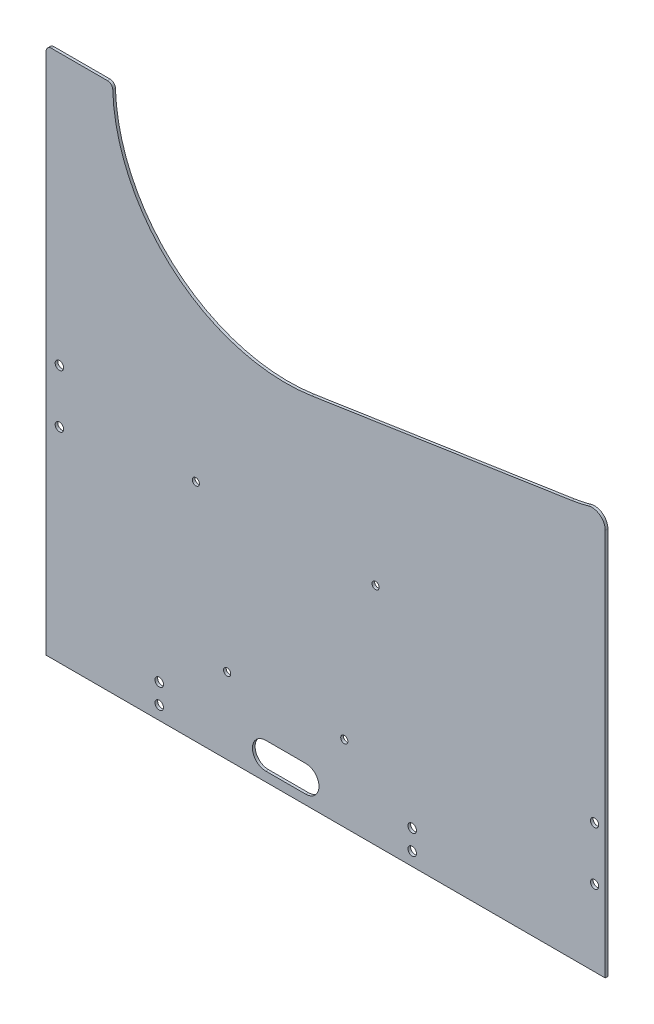
from build123d import *

# Parameters (mm, degrees)
SKETCH_1_W           = 210
SKETCH_1_H           = 233
EXTRUDE_1_DEPTH      = 1
SKETCH_2_R           = 65
CUT_EXTRUDE_1_DEPTH  = 2
SKETCH_3_W           = 210
SKETCH_3_H           = 16.25
CUT_EXTRUDE_2_DEPTH  = 2
SKETCH_4_W           = 210
SKETCH_4_H           = 0.1
CUT_EXTRUDE_3_DEPTH  = 2
CUT_EXTRUDE_4_DEPTH  = 2
SKETCH_8_R           = 1.6
CUT_EXTRUDE_6_DEPTH  = 1
SKETCH_12_R          = 1.35
CUT_EXTRUDE_9_DEPTH  = 10
CUT_EXTRUDE_10_DEPTH = 10
FILLET_3_R           = 2
SKETCH_15_R          = 1.6
CUT_EXTRUDE_12_DEPTH = 10
SKETCH_17_R          = 1.55
CUT_EXTRUDE_13_DEPTH = 10
CUT_EXTRUDE_14_DEPTH = 10
FILLET_6_R           = 5
SKETCH_24_W          = 210
SKETCH_24_H          = 18.25
CUT_EXTRUDE_18_DEPTH = 10


with BuildPart() as part:
    # 草图1 → 凸台-拉伸1 (new body)
    with BuildSketch(Plane.XY):
        Rectangle(SKETCH_1_W, SKETCH_1_H)
    extrude(amount=EXTRUDE_1_DEPTH)

    # 草图2 → 切除-拉伸1 (cut)
    with BuildSketch(Plane.XY.offset(1)):
        with Locations((-15, 100.25)):
            Circle(SKETCH_2_R)
    extrude(amount=-CUT_EXTRUDE_1_DEPTH, mode=Mode.SUBTRACT)

    # 草图3 → 切除-拉伸2 (cut)
    with BuildSketch(Plane.XY.offset(1)):
        with Locations((0, 108.375)):
            Rectangle(SKETCH_3_W, SKETCH_3_H)
    extrude(amount=-CUT_EXTRUDE_2_DEPTH, mode=Mode.SUBTRACT)

    # 草图4 → 切除-拉伸3 (cut)
    with BuildSketch(Plane.XY.offset(1)):
        with Locations((0, 100.2)):
            Rectangle(SKETCH_4_W, SKETCH_4_H)
    extrude(amount=-CUT_EXTRUDE_3_DEPTH, mode=Mode.SUBTRACT)

    # 草图5 → 切除-拉伸4 (cut)
    with BuildSketch(Plane.XY.offset(1)):
        with BuildLine():
            Line((4.5, 38.243951908), (95.5, 66.86212795))
            ThreePointArc((95.5, 66.86212795), (105.715966735, 128.460790883), (50.000008252, 100.274034742))
            Line((50.000008252, 100.274034742), (49.999923077, 100.15))
            ThreePointArc((49.999923077, 100.15), (37.375079452, 61.755181486), (4.5, 38.243951908))
        make_face()
    extrude(amount=-CUT_EXTRUDE_4_DEPTH, mode=Mode.SUBTRACT)

    # 草图8 → 切除-拉伸6 (cut)
    with BuildSketch(Plane.XY.offset(1)):
        with Locations((-100, -21.5)):
            Circle(SKETCH_8_R)
        with Locations((-100, -1.5)):
            Circle(SKETCH_8_R)
    extrude(amount=-CUT_EXTRUDE_6_DEPTH, mode=Mode.SUBTRACT)

    # 草图12 → 切除-拉伸9 (cut)
    with BuildSketch(Plane(origin=(0, 0, 0), x_dir=(-1, 0, 0), z_dir=(0, 0, -1))):
        with Locations((-18.75, -13.7)):
            Circle(SKETCH_12_R)
        with Locations((48.75, -13.7)):
            Circle(SKETCH_12_R)
        with Locations((-7, -69.7)):
            Circle(SKETCH_12_R)
        with Locations((37, -69.7)):
            Circle(SKETCH_12_R)
    extrude(amount=-CUT_EXTRUDE_9_DEPTH, mode=Mode.SUBTRACT)

    # 草图13 → 切除-拉伸10 (cut)
    with BuildSketch(Plane(origin=(0, 0, 0), x_dir=(-1, 0, 0), z_dir=(0, 0, -1))):
        with BuildLine():
            Line((7.5, -84.7), (22.5, -84.7))
            ThreePointArc((22.5, -84.7), (27.5, -89.7), (22.5, -94.7))
            Line((22.5, -94.7), (7.5, -94.7))
            ThreePointArc((7.5, -94.7), (2.5, -89.7), (7.5, -84.7))
        make_face()
    extrude(amount=-CUT_EXTRUDE_10_DEPTH, mode=Mode.SUBTRACT)

    # 圆角3
    fillet_3_edges = [part.edges().sort_by_distance(p)[0] for p in [
        (105, 71.527186767, 0.5),
        (-79.999923077, 100.15, 0.5),
        (-105, 100.15, 0.5),
        (105, -116.5, 0.5),
        (-105, -116.5, 0.5),
    ]]
    fillet(fillet_3_edges, radius=FILLET_3_R)

    # 草图15 → 切除-拉伸12 (cut)
    with BuildSketch(Plane(origin=(0, 0, 0), x_dir=(-1, 0, 0), z_dir=(0, 0, -1))):
        with Locations((-32.5, -85.75)):
            Circle(SKETCH_15_R)
        with Locations((-32.5, -93.25)):
            Circle(SKETCH_15_R)
        with Locations((62.5, -85.75)):
            Circle(SKETCH_15_R)
        with Locations((62.5, -93.25)):
            Circle(SKETCH_15_R)
    extrude(amount=-CUT_EXTRUDE_12_DEPTH, mode=Mode.SUBTRACT)

    # 草图17 → 切除-拉伸13 (cut)
    with BuildSketch(Plane(origin=(0, 0, 0), x_dir=(-1, 0, 0), z_dir=(0, 0, -1))):
        with Locations((-101, -49.75)):
            Circle(SKETCH_17_R)
        with Locations((-101, -69.75)):
            Circle(SKETCH_17_R)
    extrude(amount=-CUT_EXTRUDE_13_DEPTH, mode=Mode.SUBTRACT)

    # 草图18 → 切除-拉伸14 (cut)
    with BuildSketch(Plane(origin=(0, 0, 0), x_dir=(-1, 0, 0), z_dir=(0, 0, -1))):
        with BuildLine():
            Line((-92.5, 50.815700167), (5.25, 35.985410217))
            Line((5.25, 35.985410217), (-105, 79.42424305))
            Line((-105, 79.42424305), (-105, 54.42424305))
            ThreePointArc((-105, 54.42424305), (-98.86787278, 52.211660056), (-92.5, 50.815700167))
        make_face()
    extrude(amount=-CUT_EXTRUDE_14_DEPTH, mode=Mode.SUBTRACT)

    # 圆角6
    fillet_6_edges = [part.edges().sort_by_distance(p)[0] for p in [
        (105, 54.42424305, 0.5),
    ]]
    fillet(fillet_6_edges, radius=FILLET_6_R)

    # 草图24 → 切除-拉伸18 (cut)
    with BuildSketch(Plane.XY.offset(1)):
        with Locations((0, -107.375)):
            Rectangle(SKETCH_24_W, SKETCH_24_H)
    extrude(amount=-CUT_EXTRUDE_18_DEPTH, mode=Mode.SUBTRACT)


solid = part.part
